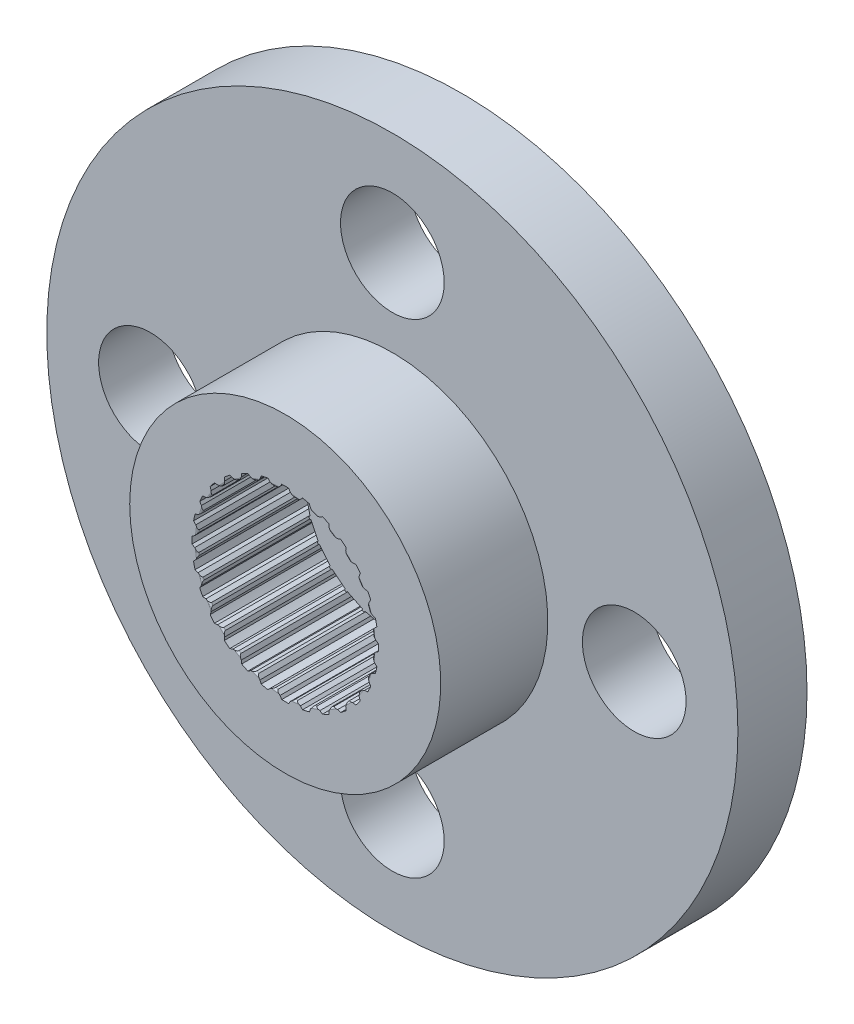
from build123d import *

# Parameters (mm, degrees)
CROQUIS1_R              = 10
CROQUIS1_R_2            = 1.5
SALIENTE_EXTRUIR1_DEPTH = 2
CROQUIS3_R              = 4.5
CROQUIS3_R_2            = 2.55
SALIENTE_EXTRUIR3_DEPTH = 3.1
CORTAR_EXTRUIR2_START   = -3.4
CORTAR_EXTRUIR2_DEPTH   = 3.4
REDONDEO1_R             = 0.05
MATRIZC1_COUNT          = 28


with BuildPart() as part:
    # Croquis1 → Saliente-Extruir1 (new body)
    with BuildSketch(Plane.XY):
        Circle(CROQUIS1_R)
        with Locations((-7, 0)):
            Circle(CROQUIS1_R_2, mode=Mode.SUBTRACT)
        with Locations((0, 7)):
            Circle(CROQUIS1_R_2, mode=Mode.SUBTRACT)
        with Locations((0, -7)):
            Circle(CROQUIS1_R_2, mode=Mode.SUBTRACT)
        with Locations((7, 0)):
            Circle(CROQUIS1_R_2, mode=Mode.SUBTRACT)
        Circle(CROQUIS1_R_2, mode=Mode.SUBTRACT)
    extrude(amount=SALIENTE_EXTRUIR1_DEPTH)

    # Croquis3 → Saliente-Extruir3 (add)
    with BuildSketch(Plane.XY.offset(2)):
        with Locations(Location((0, 0, 0), (0, 0, 180))):
            Circle(CROQUIS3_R)
        with Locations(Location((0, 0, 0), (0, 0, 180))):
            Circle(CROQUIS3_R_2, mode=Mode.SUBTRACT)
    extrude(amount=SALIENTE_EXTRUIR3_DEPTH)

    # Croquis4 → Cortar-Extruir2 (cut)
    with BuildSketch(Plane.XY.offset(5.1).offset(CORTAR_EXTRUIR2_START)):
        with BuildLine():
            Line((0, 2.7), (0, 2.55))
            ThreePointArc((0, 2.55), (0.125150818, 2.546927025), (0.25, 2.537715508))
            Line((0.25, 2.537715508), (0.15, 2.62))
            Line((0.15, 2.62), (0.1, 2.698147513))
            ThreePointArc((0.1, 2.698147513), (0.050008579, 2.699536838), (0, 2.7))
        make_face()
        with BuildLine():
            ThreePointArc((-0.25, 2.537715508), (-0.125150818, 2.546927025), (0, 2.55))
            Line((0, 2.55), (0, 2.7))
            ThreePointArc((0, 2.7), (-0.050008579, 2.699536838), (-0.1, 2.698147513))
            Line((-0.1, 2.698147513), (-0.15, 2.62))
            Line((-0.15, 2.62), (-0.25, 2.537715508))
        make_face()
        with BuildLine():
            Line((0, 2.55), (0, 2.497452058))
            Line((0, 2.497452058), (0.246033494, 2.497452058))
            Line((0.246033494, 2.497452058), (0.25, 2.537715508))
            ThreePointArc((0.25, 2.537715508), (0.125150818, 2.546927025), (0, 2.55))
        make_face()
        with BuildLine():
            Line((-0.246033494, 2.497452058), (0, 2.497452058))
            Line((0, 2.497452058), (0, 2.55))
            ThreePointArc((0, 2.55), (-0.125150818, 2.546927025), (-0.25, 2.537715508))
            Line((-0.25, 2.537715508), (-0.246033494, 2.497452058))
        make_face()
    cortar_extruir2 = extrude(amount=CORTAR_EXTRUIR2_DEPTH, mode=Mode.SUBTRACT)

    # Redondeo1
    redondeo1_edges = [part.edges().sort_by_distance(p)[0] for p in [
        (0, -2.55, 5.1),
    ]]
    fillet(redondeo1_edges, radius=REDONDEO1_R)

    # MatrizC1: Cortar-Extruir2 ×28 about axis
    matrizc1_axis = Axis((0, 0, 0), (0, 0, 1))
    for i in range(1, MATRIZC1_COUNT):
        add(cortar_extruir2.rotate(matrizc1_axis, i * 360 / MATRIZC1_COUNT), mode=Mode.SUBTRACT)


solid = part.part
